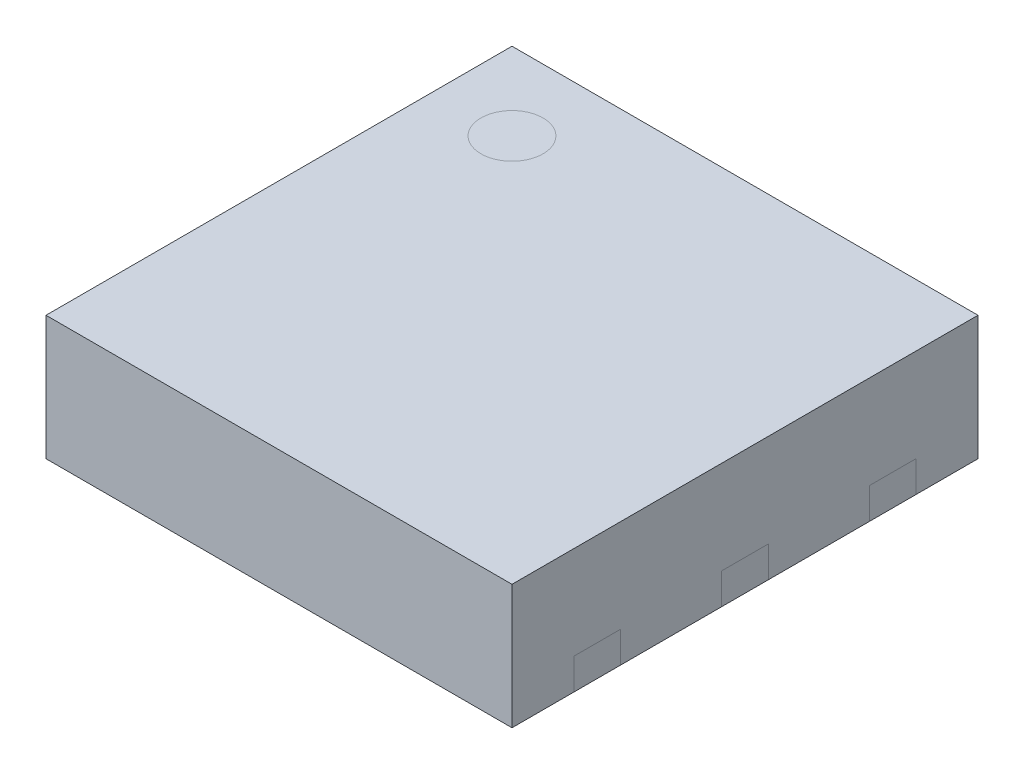
from build123d import *

# Parameters (mm, degrees)
SKETCH_1_W      = 3
SKETCH_1_H      = 3
EXTRUDE_1_DEPTH = 0.8


with BuildPart() as part:
    # Эскиз1 → Бобышка-Вытянуть1 (new body)
    with BuildSketch(Plane(origin=(0, 0, 0), x_dir=(1, 0, 0), z_dir=(0, 1, 0))):
        Rectangle(SKETCH_1_W, SKETCH_1_H)
    extrude(amount=EXTRUDE_1_DEPTH)


solid = part.part
